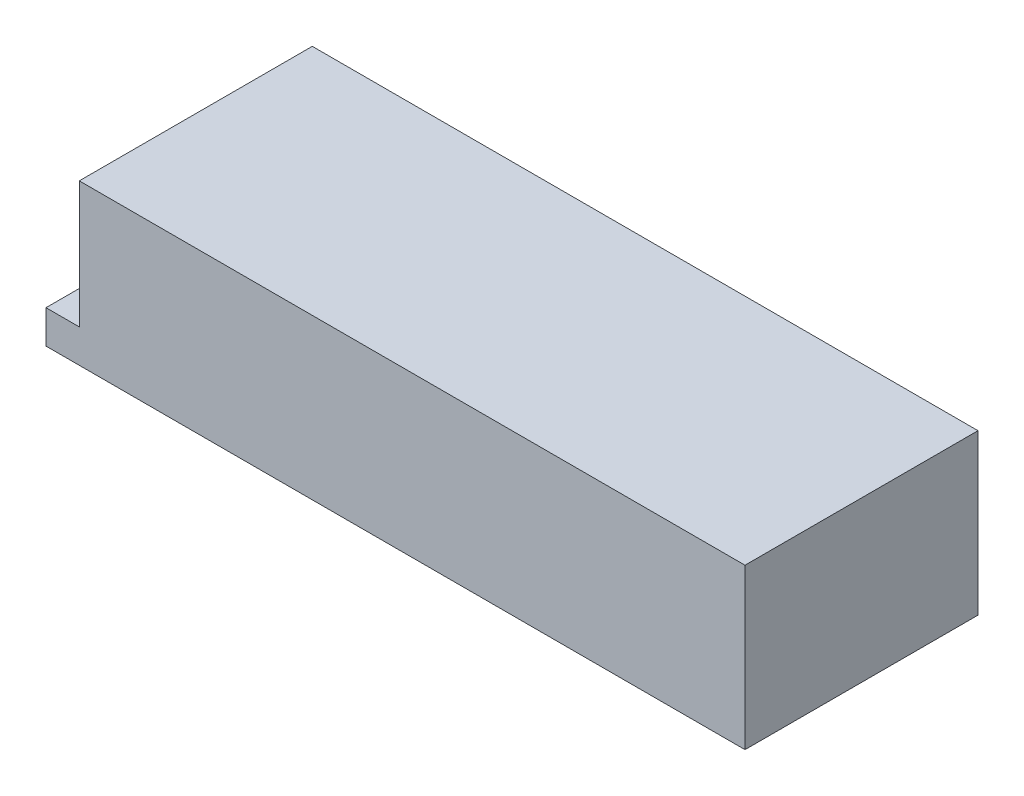
from build123d import *

# Parameters (mm, degrees)
SKETCH1_W      = 100
SKETCH1_H      = 35
EXTRUDE1_DEPTH = 24
SKETCH2_W      = 35
SKETCH2_H      = 5
EXTRUDE2_DEPTH = 5


with BuildPart() as part:
    # Sketch1 → Extrude1 (new body)
    with BuildSketch(Plane(origin=(0, 0, 0), x_dir=(1, 0, 0), z_dir=(0, 1, 0))):
        with Locations((-17.631525754, 40.747794601)):
            Rectangle(SKETCH1_W, SKETCH1_H)
    extrude(amount=EXTRUDE1_DEPTH)

    # Sketch2 → Extrude2 (add)
    with BuildSketch(Plane.ZY.offset(67.631525754)):
        with Locations((-40.747794601, 2.5)):
            Rectangle(SKETCH2_W, SKETCH2_H)
    extrude(amount=EXTRUDE2_DEPTH)


solid = part.part
